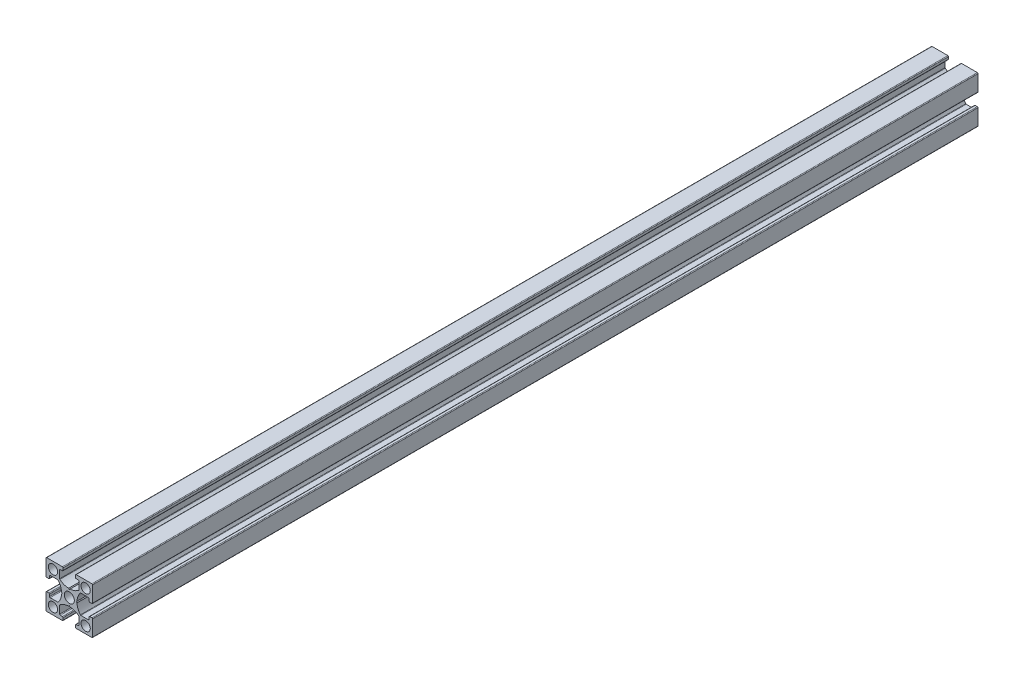
from build123d import *

# Parameters (mm, degrees)
MODEL_R         = 2.15
MODEL_R_2       = 2
EXTRUDE_1_DEPTH = 380


with BuildPart() as part:
    # Model → 보스-돌출1 (new body)
    with BuildSketch(Plane.XY):
        with BuildLine():
            Line((2307.763927197, 1192.134297913), (2307.763927197, 1195.391548465))
            ThreePointArc((2307.763927197, 1195.391548465), (2307.676059232, 1195.603680499), (2307.463927197, 1195.691548465))
            Line((2307.463927197, 1195.691548465), (2306.563927197, 1195.691548465))
            ThreePointArc((2306.563927197, 1195.691548465), (2306.351795163, 1195.779416431), (2306.263927197, 1195.991548465))
            Line((2306.263927197, 1195.991548465), (2306.263927197, 1196.891548465))
            ThreePointArc((2306.263927197, 1196.891548465), (2306.351795163, 1197.103680499), (2306.563927197, 1197.191548465))
            Line((2306.563927197, 1197.191548465), (2313.313927197, 1197.191548465))
            ThreePointArc((2313.313927197, 1197.191548465), (2313.526059232, 1197.103680499), (2313.613927197, 1196.891548465))
            Line((2313.613927197, 1196.891548465), (2313.613927197, 1190.141548465))
            ThreePointArc((2313.613927197, 1190.141548465), (2313.526059232, 1189.929416431), (2313.313927197, 1189.841548465))
            Line((2313.313927197, 1189.841548465), (2312.413927197, 1189.841548465))
            ThreePointArc((2312.413927197, 1189.841548465), (2312.201795163, 1189.929416431), (2312.113927197, 1190.141548465))
            Line((2312.113927197, 1190.141548465), (2312.113927197, 1191.041548465))
            ThreePointArc((2312.113927197, 1191.041548465), (2312.026059232, 1191.253680499), (2311.813927197, 1191.341548465))
            Line((2311.813927197, 1191.341548465), (2308.556676645, 1191.341548465))
            ThreePointArc((2308.556676645, 1191.341548465), (2308.426234796, 1191.311705686), (2308.321744595, 1191.228114625))
            ThreePointArc((2308.321744595, 1191.228114625), (2307.328306374, 1189.47356999), (2306.921204563, 1187.498825831))
            Line((2306.921204563, 1187.498825831), (2306.613927197, 1187.191548465))
            Line((2306.613927197, 1187.191548465), (2306.921204563, 1186.884271099))
            ThreePointArc((2306.921204563, 1186.884271099), (2307.328306374, 1184.90952694), (2308.321744595, 1183.154982305))
            ThreePointArc((2308.321744595, 1183.154982305), (2308.426234796, 1183.071391244), (2308.556676645, 1183.041548465))
            Line((2308.556676645, 1183.041548465), (2311.813927197, 1183.041548465))
            ThreePointArc((2311.813927197, 1183.041548465), (2312.026059232, 1183.129416431), (2312.113927197, 1183.341548465))
            Line((2312.113927197, 1183.341548465), (2312.113927197, 1184.241548465))
            ThreePointArc((2312.113927197, 1184.241548465), (2312.201795163, 1184.453680499), (2312.413927197, 1184.541548465))
            Line((2312.413927197, 1184.541548465), (2313.313927197, 1184.541548465))
            ThreePointArc((2313.313927197, 1184.541548465), (2313.526059232, 1184.453680499), (2313.613927197, 1184.241548465))
            Line((2313.613927197, 1184.241548465), (2313.613927197, 1177.491548465))
            ThreePointArc((2313.613927197, 1177.491548465), (2313.526059232, 1177.279416431), (2313.313927197, 1177.191548465))
            Line((2313.313927197, 1177.191548465), (2306.563927197, 1177.191548465))
            ThreePointArc((2306.563927197, 1177.191548465), (2306.351795163, 1177.279416431), (2306.263927197, 1177.491548465))
            Line((2306.263927197, 1177.491548465), (2306.263927197, 1178.391548465))
            ThreePointArc((2306.263927197, 1178.391548465), (2306.351795163, 1178.603680499), (2306.563927197, 1178.691548465))
            Line((2306.563927197, 1178.691548465), (2307.463927197, 1178.691548465))
            ThreePointArc((2307.463927197, 1178.691548465), (2307.676059232, 1178.779416431), (2307.763927197, 1178.991548465))
            Line((2307.763927197, 1178.991548465), (2307.763927197, 1182.248799017))
            ThreePointArc((2307.763927197, 1182.248799017), (2307.734084418, 1182.379240866), (2307.650493357, 1182.483731067))
            ThreePointArc((2307.650493357, 1182.483731067), (2305.895948722, 1183.477169289), (2303.921204563, 1183.884271099))
            Line((2303.921204563, 1183.884271099), (2303.613927197, 1184.191548465))
            Line((2303.613927197, 1184.191548465), (2303.306649831, 1183.884271099))
            ThreePointArc((2303.306649831, 1183.884271099), (2301.331905673, 1183.477169289), (2299.577361038, 1182.483731067))
            ThreePointArc((2299.577361038, 1182.483731067), (2299.493769977, 1182.379240866), (2299.463927197, 1182.248799017))
            Line((2299.463927197, 1182.248799017), (2299.463927197, 1178.991548465))
            ThreePointArc((2299.463927197, 1178.991548465), (2299.551795163, 1178.779416431), (2299.763927197, 1178.691548465))
            Line((2299.763927197, 1178.691548465), (2300.663927197, 1178.691548465))
            ThreePointArc((2300.663927197, 1178.691548465), (2300.876059232, 1178.603680499), (2300.963927197, 1178.391548465))
            Line((2300.963927197, 1178.391548465), (2300.963927197, 1177.491548465))
            ThreePointArc((2300.963927197, 1177.491548465), (2300.876059232, 1177.279416431), (2300.663927197, 1177.191548465))
            Line((2300.663927197, 1177.191548465), (2293.913927197, 1177.191548465))
            ThreePointArc((2293.913927197, 1177.191548465), (2293.701795163, 1177.279416431), (2293.613927197, 1177.491548465))
            Line((2293.613927197, 1177.491548465), (2293.613927197, 1184.241548465))
            ThreePointArc((2293.613927197, 1184.241548465), (2293.701795163, 1184.453680499), (2293.913927197, 1184.541548465))
            Line((2293.913927197, 1184.541548465), (2294.813927197, 1184.541548465))
            ThreePointArc((2294.813927197, 1184.541548465), (2295.026059232, 1184.453680499), (2295.113927197, 1184.241548465))
            Line((2295.113927197, 1184.241548465), (2295.113927197, 1183.341548465))
            ThreePointArc((2295.113927197, 1183.341548465), (2295.201795163, 1183.129416431), (2295.413927197, 1183.041548465))
            Line((2295.413927197, 1183.041548465), (2298.671177749, 1183.041548465))
            ThreePointArc((2298.671177749, 1183.041548465), (2298.801619599, 1183.071391244), (2298.906109799, 1183.154982305))
            ThreePointArc((2298.906109799, 1183.154982305), (2299.899548021, 1184.90952694), (2300.306649831, 1186.884271099))
            Line((2300.306649831, 1186.884271099), (2300.613927197, 1187.191548465))
            Line((2300.613927197, 1187.191548465), (2300.306649831, 1187.498825831))
            ThreePointArc((2300.306649831, 1187.498825831), (2299.899548021, 1189.47356999), (2298.906109799, 1191.228114625))
            ThreePointArc((2298.906109799, 1191.228114625), (2298.801619599, 1191.311705686), (2298.671177749, 1191.341548465))
            Line((2298.671177749, 1191.341548465), (2295.413927197, 1191.341548465))
            ThreePointArc((2295.413927197, 1191.341548465), (2295.201795163, 1191.253680499), (2295.113927197, 1191.041548465))
            Line((2295.113927197, 1191.041548465), (2295.113927197, 1190.141548465))
            ThreePointArc((2295.113927197, 1190.141548465), (2295.026059232, 1189.929416431), (2294.813927197, 1189.841548465))
            Line((2294.813927197, 1189.841548465), (2293.913927197, 1189.841548465))
            ThreePointArc((2293.913927197, 1189.841548465), (2293.701795163, 1189.929416431), (2293.613927197, 1190.141548465))
            Line((2293.613927197, 1190.141548465), (2293.613927197, 1196.891548465))
            ThreePointArc((2293.613927197, 1196.891548465), (2293.701795163, 1197.103680499), (2293.913927197, 1197.191548465))
            Line((2293.913927197, 1197.191548465), (2300.663927197, 1197.191548465))
            ThreePointArc((2300.663927197, 1197.191548465), (2300.876059232, 1197.103680499), (2300.963927197, 1196.891548465))
            Line((2300.963927197, 1196.891548465), (2300.963927197, 1195.991548465))
            ThreePointArc((2300.963927197, 1195.991548465), (2300.876059232, 1195.779416431), (2300.663927197, 1195.691548465))
            Line((2300.663927197, 1195.691548465), (2299.763927197, 1195.691548465))
            ThreePointArc((2299.763927197, 1195.691548465), (2299.551795163, 1195.603680499), (2299.463927197, 1195.391548465))
            Line((2299.463927197, 1195.391548465), (2299.463927197, 1192.134297913))
            ThreePointArc((2299.463927197, 1192.134297913), (2299.493769977, 1192.003856063), (2299.577361038, 1191.899365863))
            ThreePointArc((2299.577361038, 1191.899365863), (2301.331905673, 1190.905927641), (2303.306649831, 1190.498825831))
            Line((2303.306649831, 1190.498825831), (2303.613927197, 1190.191548465))
            Line((2303.613927197, 1190.191548465), (2303.921204563, 1190.498825831))
            ThreePointArc((2303.921204563, 1190.498825831), (2305.895948722, 1190.905927641), (2307.650493357, 1191.899365863))
            ThreePointArc((2307.650493357, 1191.899365863), (2307.734084418, 1192.003856063), (2307.763927197, 1192.134297913))
        make_face()
        with Locations((2303.613927197, 1187.191548465)):
            Circle(MODEL_R, mode=Mode.SUBTRACT)
        with Locations((2296.613927197, 1194.191548465)):
            Circle(MODEL_R_2, mode=Mode.SUBTRACT)
        with Locations((2296.613927197, 1180.191548465)):
            Circle(MODEL_R_2, mode=Mode.SUBTRACT)
        with Locations((2310.613927197, 1194.191548465)):
            Circle(MODEL_R_2, mode=Mode.SUBTRACT)
        with Locations((2310.613927197, 1180.191548465)):
            Circle(MODEL_R_2, mode=Mode.SUBTRACT)
    extrude(amount=EXTRUDE_1_DEPTH)


solid = part.part
